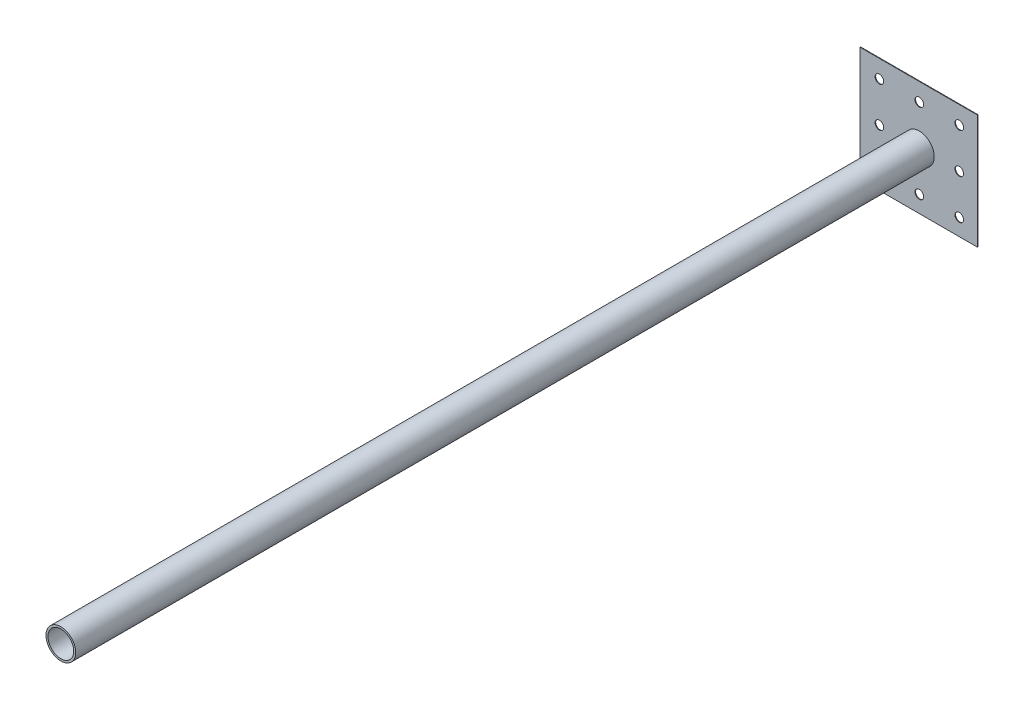
from build123d import *

# Parameters (mm, degrees)
SKETCH_1_W          = 41
SKETCH_1_H          = 40
EXTRUDE_1_DEPTH     = 0.2
SKETCH_5_R          = 4.5
CUT_EXTRUDE_3_DEPTH = 0.2
SKETCH_6_R          = 1.5
CUT_EXTRUDE_4_DEPTH = 0.2
EXTRUDE_START       = 300
SKETCH_7_R          = 5.2
SKETCH_7_R_2        = 4.5
EXTRUDE_2_DEPTH     = 300


with BuildPart() as part:
    # 스케치1 → 보스-돌출1 (new body)
    with BuildSketch(Plane.XY):
        with Locations((20.5, 20)):
            Rectangle(SKETCH_1_W, SKETCH_1_H)
    extrude(amount=EXTRUDE_1_DEPTH)

    # 스케치5 → 컷-돌출3 (cut)
    with BuildSketch(Plane.XY.offset(0.2)):
        with Locations((20.7, 19.8)):
            Circle(SKETCH_5_R)
    extrude(amount=-CUT_EXTRUDE_3_DEPTH, mode=Mode.SUBTRACT)

    # 스케치6 → 컷-돌출4 (cut)
    with BuildSketch(Plane.XY.offset(0.2)):
        with Locations((20.7, 33.75)):
            Circle(SKETCH_6_R)
        with Locations((34.65, 33.75)):
            Circle(SKETCH_6_R)
        with Locations((34.65, 19.8)):
            Circle(SKETCH_6_R)
        with Locations((20.7, 5.85)):
            Circle(SKETCH_6_R)
        with Locations((34.65, 5.85)):
            Circle(SKETCH_6_R)
        with Locations((6.75, 5.85)):
            Circle(SKETCH_6_R)
        with Locations((6.75, 33.75)):
            Circle(SKETCH_6_R)
        with Locations((6.75, 19.8)):
            Circle(SKETCH_6_R)
    extrude(amount=-CUT_EXTRUDE_4_DEPTH, mode=Mode.SUBTRACT)

    # 스케치7 → 보스-돌출2 (add)
    with BuildSketch(Plane.XY.offset(0.2).offset(EXTRUDE_START)):
        with Locations((20.7, 19.8)):
            Circle(SKETCH_7_R)
        with Locations((20.7, 19.8)):
            Circle(SKETCH_7_R_2, mode=Mode.SUBTRACT)
    extrude(amount=-EXTRUDE_2_DEPTH)


solid = part.part
